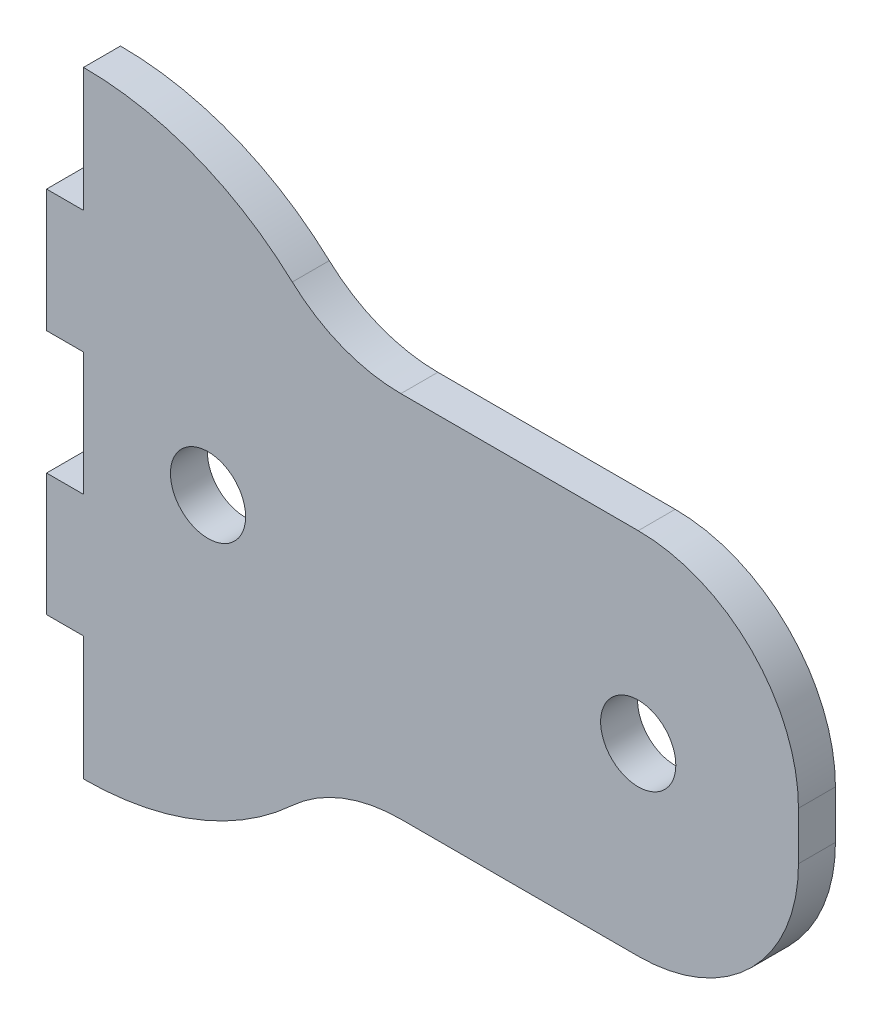
from build123d import *

# Parameters (mm, degrees)
BOSS_EXTRUDE1_DEPTH            = 3
F_6_1_6_1_DIAMETER_HOLE1_D     = 6.1
F_6_1_6_1_DIAMETER_HOLE1_DEPTH = 10
F_6_1_6_1_DIAMETER_HOLE1_TIP   = 1.832624888


with BuildPart() as part:
    # Sketch1 → Boss-Extrude1 (new body)
    with BuildSketch(Plane.XY):
        with BuildLine():
            Line((0, 25), (0, 14.95))
            Line((0, 14.95), (-3, 14.95))
            Line((-3, 14.95), (-3, 5))
            Line((-3, 5), (0, 5))
            Line((0, 5), (0, -5))
            Line((0, -5), (-3, -5))
            Line((-3, -5), (-3, -14.95))
            Line((-3, -14.95), (0, -14.95))
            Line((0, -14.95), (0, -25))
            ThreePointArc((0, -25), (9.091095991, -23.288451509), (16.937403852, -18.388157895))
            ThreePointArc((16.937403852, -18.388157895), (21.017483939, -15.840005215), (25.744853855, -14.95))
            Line((25.744853855, -14.95), (45, -14.95))
            ThreePointArc((45, -14.95), (54.192388155, -11.142388155), (58, -1.95))
            Line((58, -1.95), (58, 1.95))
            ThreePointArc((58, 1.95), (54.192388155, 11.142388155), (45, 14.95))
            Line((45, 14.95), (25.744853855, 14.95))
            ThreePointArc((25.744853855, 14.95), (21.017483939, 15.840005215), (16.937403852, 18.388157895))
            ThreePointArc((16.937403852, 18.388157895), (9.091095991, 23.288451509), (0, 25))
        make_face()
    extrude(amount=BOSS_EXTRUDE1_DEPTH)

    # Ø6.1 (6.1) Diameter Hole1
    with Locations(Plane.XY.offset(3)):
        with Locations((10.1, 0), (45, 0)):
            Hole(F_6_1_6_1_DIAMETER_HOLE1_D / 2, depth=F_6_1_6_1_DIAMETER_HOLE1_DEPTH)
            with Locations((0, 0, -(F_6_1_6_1_DIAMETER_HOLE1_DEPTH + F_6_1_6_1_DIAMETER_HOLE1_TIP / 2))):  # 118° drill point
                Cone(0, F_6_1_6_1_DIAMETER_HOLE1_D / 2, F_6_1_6_1_DIAMETER_HOLE1_TIP, mode=Mode.SUBTRACT)


solid = part.part
